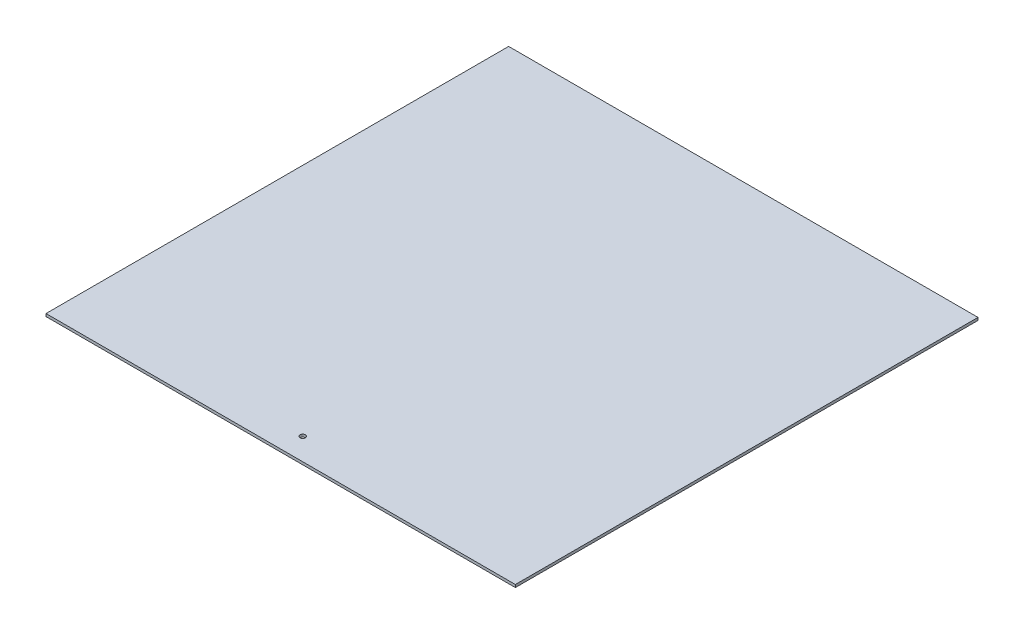
from build123d import *

# Parameters (mm, degrees)
SKETCH1_W           = 350
SKETCH1_H           = 345
SKETCH1_R           = 2
BOSS_EXTRUDE1_DEPTH = 2


with BuildPart() as part:
    # Sketch1 → Boss-Extrude1 (new body)
    with BuildSketch(Plane(origin=(0, 0, 0), x_dir=(1, 0, 0), z_dir=(0, 1, 0))):
        with Locations((0, -1.057091064)):
            Rectangle(SKETCH1_W, SKETCH1_H)
        with Locations(Location((0, -157.092188887, 0), (0, 0, 270))):
            Circle(SKETCH1_R, mode=Mode.SUBTRACT)
    extrude(amount=BOSS_EXTRUDE1_DEPTH)


solid = part.part
